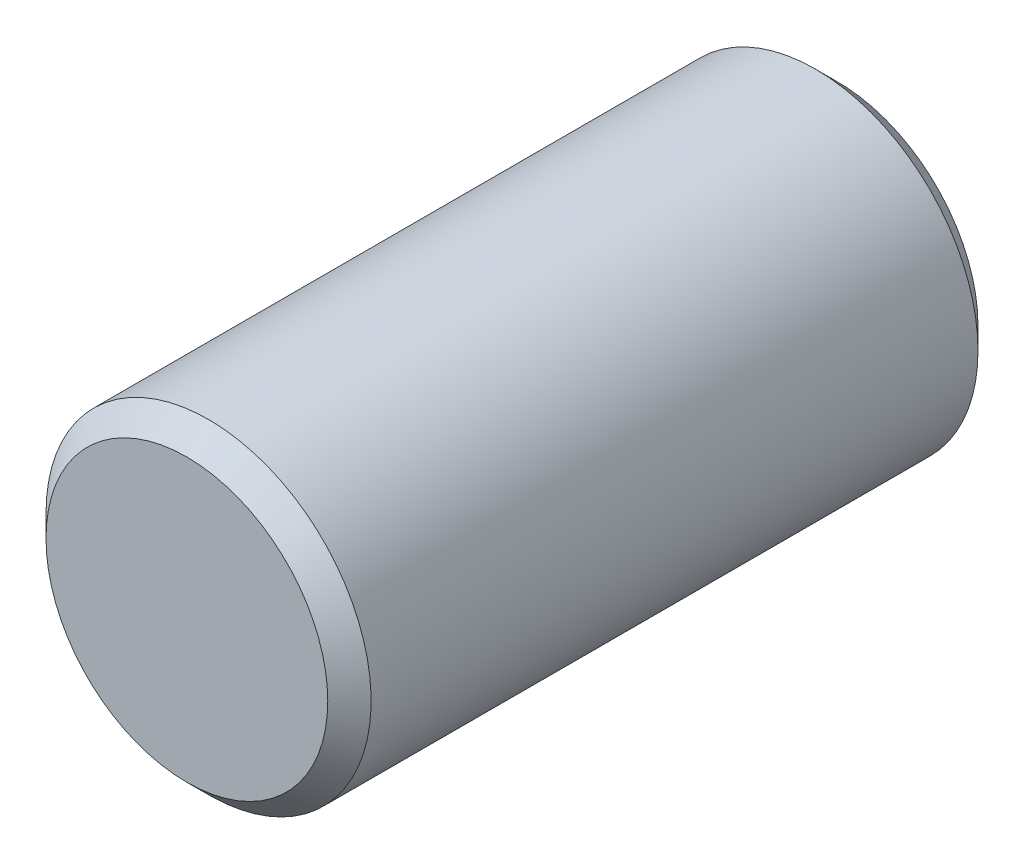
from build123d import *

# Parameters (mm, degrees)
SKETCH1_R           = 9.525
BOSS_EXTRUDE1_DEPTH = 38.1
CHAMFER1_SIZE       = 1.27


with BuildPart() as part:
    # Sketch1 → Boss-Extrude1 (new body)
    with BuildSketch(Plane.XY):
        with Locations(Location((0, 0, 0), (0, 0, 180))):
            Circle(SKETCH1_R)
    extrude(amount=BOSS_EXTRUDE1_DEPTH)

    # Chamfer1
    chamfer1_edges = [part.edges().sort_by_distance(p)[0] for p in [
        (9.525, 0, 0),
        (9.525, 0, 38.1),
    ]]
    chamfer(chamfer1_edges, length=CHAMFER1_SIZE)


solid = part.part
